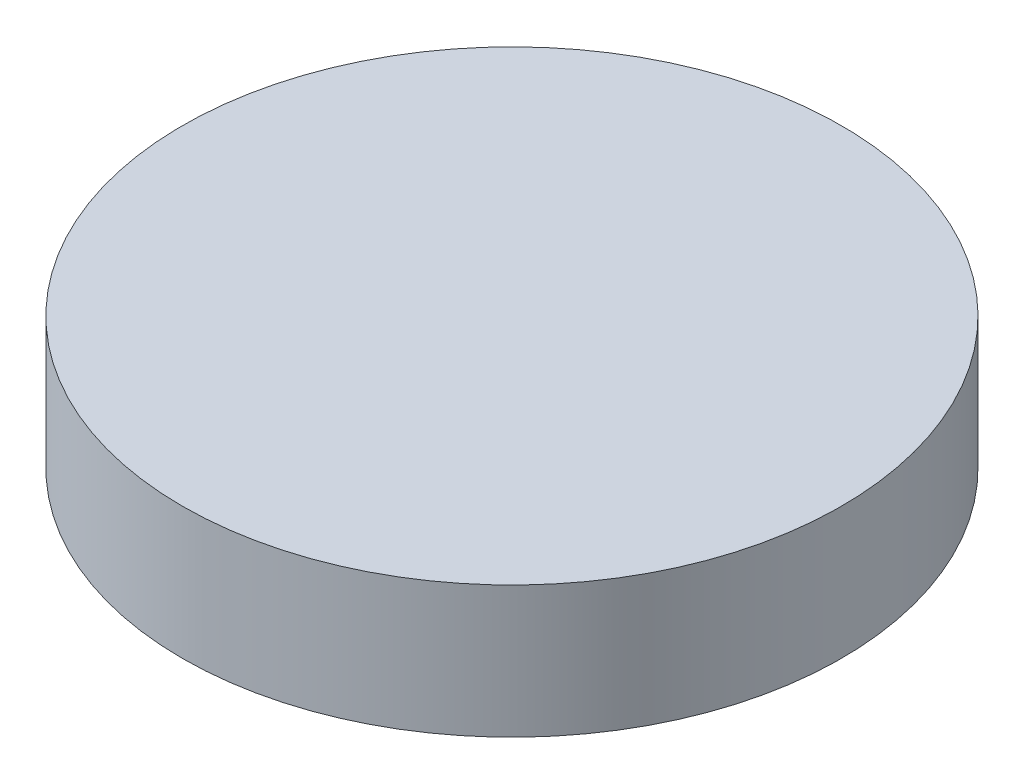
from build123d import *

# Parameters (mm, degrees)
BOSS_EXTRUDE1_DEPTH      = 3
BOSS_EXTRUDE1_DEPTH_BACK = 3
SKETCH1_R                = 15


with BuildPart() as part:
    # Sketch1 → Boss-Extrude1 (new, two sides: drawn at the far end of the back side and taken through both)
    with BuildSketch(Plane(origin=(0, 0, 0), x_dir=(1, 0, 0), z_dir=(0, 1, 0)).offset(-BOSS_EXTRUDE1_DEPTH_BACK)):
        Circle(SKETCH1_R)
    extrude(amount=BOSS_EXTRUDE1_DEPTH + BOSS_EXTRUDE1_DEPTH_BACK)


solid = part.part
